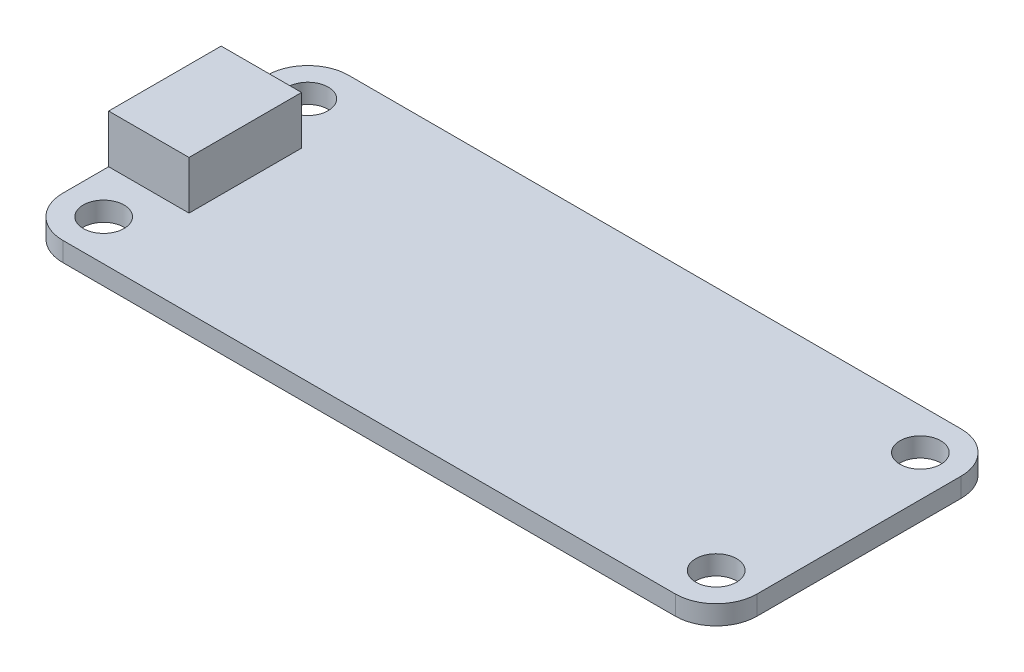
from build123d import *

# Parameters (mm, degrees)
SKETCH1_W           = 43.18
SKETCH1_H           = 17.78
SKETCH1_R           = 1.27
BOSS_EXTRUDE1_DEPTH = 1.2
FILLET1_R           = 2.54
SKETCH2_W           = 5
SKETCH2_H           = 7
BOSS_EXTRUDE2_DEPTH = 3


with BuildPart() as part:
    # Sketch1 → Boss-Extrude1 (new body)
    with BuildSketch(Plane(origin=(0, 0, 0), x_dir=(1, 0, 0), z_dir=(0, 1, 0))):
        with Locations((-21.59, 8.89)):
            Rectangle(SKETCH1_W, SKETCH1_H)
        with Locations(Location((-40.64, 15.24, 0), (0, 0, 270))):
            Circle(SKETCH1_R, mode=Mode.SUBTRACT)
        with Locations(Location((-40.64, 2.54, 0), (0, 0, 270))):
            Circle(SKETCH1_R, mode=Mode.SUBTRACT)
        with Locations(Location((-2.54, 2.54, 0), (0, 0, 270))):
            Circle(SKETCH1_R, mode=Mode.SUBTRACT)
        with Locations(Location((-2.54, 15.24, 0), (0, 0, 270))):
            Circle(SKETCH1_R, mode=Mode.SUBTRACT)
    extrude(amount=BOSS_EXTRUDE1_DEPTH)

    # Fillet1
    fillet1_edges = [part.edges().sort_by_distance(p)[0] for p in [
        (0, 0.6, 0),
        (-43.18, 0.6, 0),
        (-43.18, 0.6, -17.78),
        (0, 0.6, -17.78),
    ]]
    fillet(fillet1_edges, radius=FILLET1_R)

    # Sketch2 → Boss-Extrude2 (add)
    with BuildSketch(Plane(origin=(0, 1.2, 0), x_dir=(1, 0, 0), z_dir=(0, 1, 0))):
        with Locations((-40.68, 8.89)):
            Rectangle(SKETCH2_W, SKETCH2_H)
    extrude(amount=BOSS_EXTRUDE2_DEPTH)


solid = part.part
